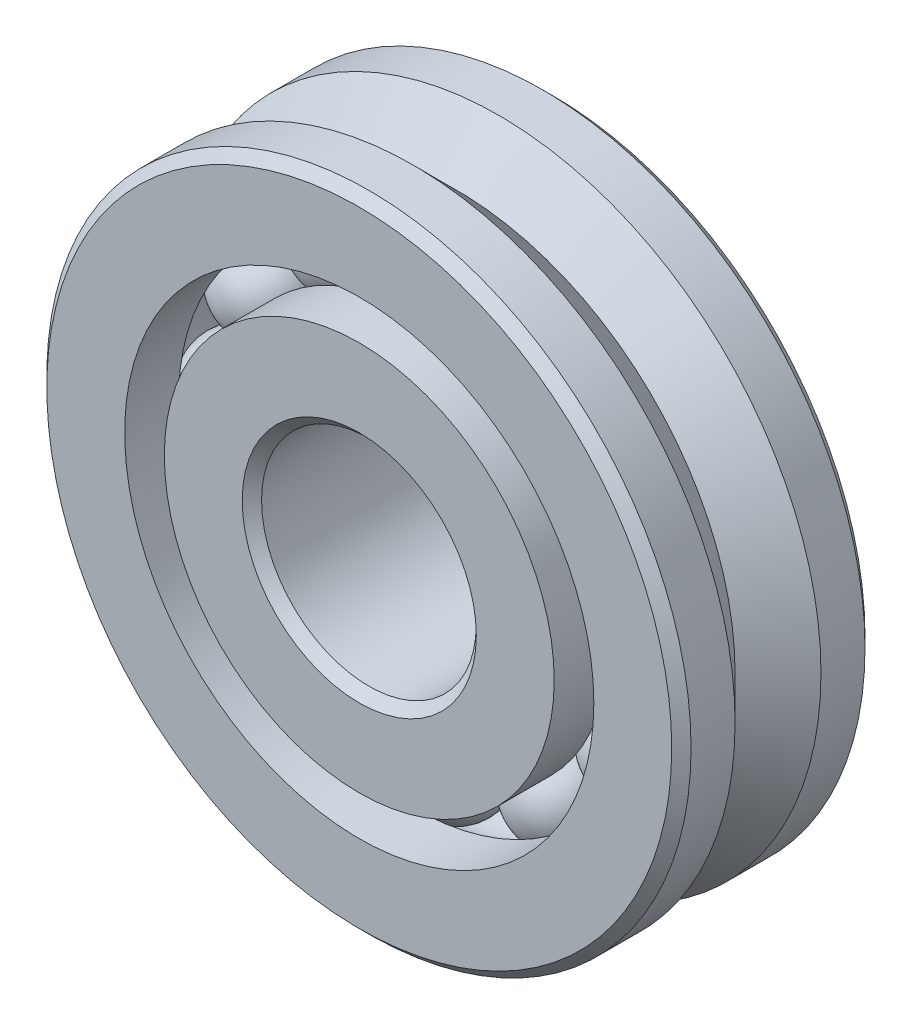
from build123d import *

# Parameters (mm, degrees)
CIRPATTERN1_COUNT = 12


with BuildPart() as part:
    # Sketch1 → Revolve1 (revolve)
    with BuildSketch(Plane(origin=(0, 0, 0), x_dir=(0, 0, -1), z_dir=(1, 0, 0))):
        with BuildLine():
            Line((4.05, 15), (2, 15))
            Line((2, 15), (0, 13))
            Line((0, 13), (-2, 15))
            Line((-2, 15), (-4.05, 15))
            Line((-4.05, 15), (-4.5, 14.55))
            Line((-4.5, 14.55), (-4.5, 10.923076923))
            Line((-4.5, 10.923076923), (-2, 10.923076923))
            ThreePointArc((-2, 10.923076923), (0, 12.202741702), (2, 10.923076923))
            Line((2, 10.923076923), (4.5, 10.923076923))
            Line((4.5, 10.923076923), (4.5, 14.55))
            Line((4.5, 14.55), (4.05, 15))
        make_face()
    revolve(axis=Axis((0, 0, 4.5), (0, 0, -1)))


with BuildPart() as body_2:
    # Sketch3 → Revolve3 (revolve)
    with BuildSketch(Plane(origin=(0, 0, 0), x_dir=(0, 0, -1), z_dir=(1, 0, 0))):
        with BuildLine():
            Line((-4.5, 9.076923077), (-2, 9.076923077))
            ThreePointArc((-2, 9.076923077), (0, 7.797258298), (2, 9.076923077))
            Line((2, 9.076923077), (4.5, 9.076923077))
            Line((4.5, 9.076923077), (4.5, 5.45))
            Line((4.5, 5.45), (4.05, 5))
            Line((4.05, 5), (-4.05, 5))
            Line((-4.05, 5), (-4.5, 5.45))
            Line((-4.5, 5.45), (-4.5, 9.076923077))
        make_face()
    revolve(axis=Axis((0, 0, 4.5), (0, 0, -1)))


with BuildPart() as body_3:
    # Sketch4 → Revolve4 (revolve)
    with BuildSketch(Plane(origin=(0, 0, 0), x_dir=(0, 0, -1), z_dir=(1, 0, 0))):
        with BuildLine():
            Line((-2.202741702, 10), (2.202741702, 10))
            ThreePointArc((2.202741702, 10), (0, 12.202741702), (-2.202741702, 10))
        make_face()
    revolve(axis=Axis((0, 10, 2.202741702), (0, 0, -1)))


with BuildPart() as cirpattern1_1:
    # CirPattern1: pattern copy
    add(body_3.part.rotate(Axis((0, 0, -4.5), (0, 0, 1)), 1 * 360 / CIRPATTERN1_COUNT))


with BuildPart() as cirpattern1_2:
    # CirPattern1: pattern copy
    add(body_3.part.rotate(Axis((0, 0, -4.5), (0, 0, 1)), 2 * 360 / CIRPATTERN1_COUNT))


with BuildPart() as cirpattern1_3:
    # CirPattern1: pattern copy
    add(body_3.part.rotate(Axis((0, 0, -4.5), (0, 0, 1)), 3 * 360 / CIRPATTERN1_COUNT))


with BuildPart() as cirpattern1_4:
    # CirPattern1: pattern copy
    add(body_3.part.rotate(Axis((0, 0, -4.5), (0, 0, 1)), 4 * 360 / CIRPATTERN1_COUNT))


with BuildPart() as cirpattern1_5:
    # CirPattern1: pattern copy
    add(body_3.part.rotate(Axis((0, 0, -4.5), (0, 0, 1)), 5 * 360 / CIRPATTERN1_COUNT))


with BuildPart() as cirpattern1_6:
    # CirPattern1: pattern copy
    add(body_3.part.rotate(Axis((0, 0, -4.5), (0, 0, 1)), 6 * 360 / CIRPATTERN1_COUNT))


with BuildPart() as cirpattern1_7:
    # CirPattern1: pattern copy
    add(body_3.part.rotate(Axis((0, 0, -4.5), (0, 0, 1)), 7 * 360 / CIRPATTERN1_COUNT))


with BuildPart() as cirpattern1_8:
    # CirPattern1: pattern copy
    add(body_3.part.rotate(Axis((0, 0, -4.5), (0, 0, 1)), 8 * 360 / CIRPATTERN1_COUNT))


with BuildPart() as cirpattern1_9:
    # CirPattern1: pattern copy
    add(body_3.part.rotate(Axis((0, 0, -4.5), (0, 0, 1)), 9 * 360 / CIRPATTERN1_COUNT))


with BuildPart() as cirpattern1_10:
    # CirPattern1: pattern copy
    add(body_3.part.rotate(Axis((0, 0, -4.5), (0, 0, 1)), 10 * 360 / CIRPATTERN1_COUNT))


with BuildPart() as cirpattern1_11:
    # CirPattern1: pattern copy
    add(body_3.part.rotate(Axis((0, 0, -4.5), (0, 0, 1)), 11 * 360 / CIRPATTERN1_COUNT))


solid = Compound([part.part, body_2.part, body_3.part, cirpattern1_1.part, cirpattern1_2.part, cirpattern1_3.part, cirpattern1_4.part, cirpattern1_5.part, cirpattern1_6.part, cirpattern1_7.part, cirpattern1_8.part, cirpattern1_9.part, cirpattern1_10.part, cirpattern1_11.part])
